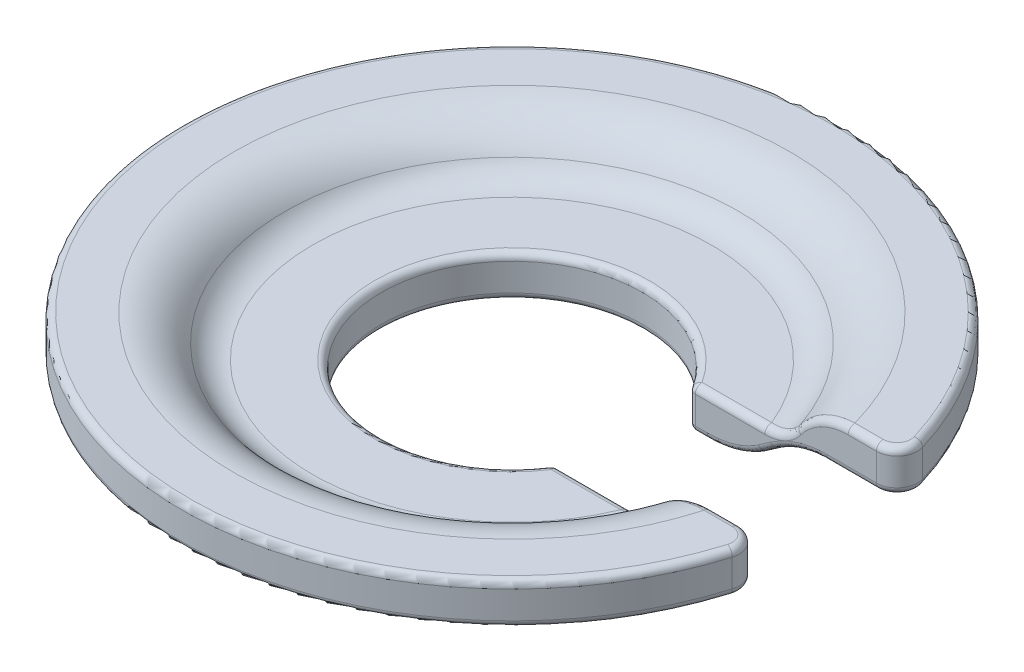
from build123d import *

# Parameters (mm, degrees)
SKETCH2_W          = 25
SKETCH2_H          = 10
CUT_EXTRUDE1_DEPTH = 35.467375879
FILLET1_R          = 1.5
FILLET2_R          = 0.5


with BuildPart() as part:
    # Sketch1 → Revolve1 (revolve)
    with BuildSketch(Plane.XY, mode=Mode.PRIVATE) as revolve1_sk:
        with BuildLine():
            Line((9.5, 0), (10.75, 0))
            ThreePointArc((10.75, 0), (12.653607892, 0.309984447), (14.360519504, 1.207907669))
            ThreePointArc((14.360519504, 1.207907669), (14.760337141, 1.508447301), (15.160821893, 1.808097391))
            ThreePointArc((15.160821893, 1.808097391), (16.859045789, 2.694233238), (18.75, 3))
            Line((18.75, 3), (24, 3))
            Line((24, 3), (24, 6))
            Line((24, 6), (20.244562647, 6))
            ThreePointArc((20.244562647, 6), (18.161467422, 5.488823672), (16.551629517, 4.071428571))
            ThreePointArc((16.551629517, 4.071428571), (15.657275125, 3.283986849), (14.5, 3))
            Line((14.5, 3), (9.5, 3))
            Line((9.5, 3), (9.5, 0))
        make_face()
    revolve(revolve1_sk.sketch.rotate(Axis((0, 0, 0), (0, 1, 0)), 90), axis=Axis((0, 0, 0), (0, 1, 0)))

    # Sketch2 → Cut-Extrude1 (cut, through all)
    with BuildSketch(Plane(origin=(0, 6, 0), x_dir=(1, 0, 0), z_dir=(0, 1, 0))):
        with Locations((12.5, 0)):
            Rectangle(SKETCH2_W, SKETCH2_H)
    extrude(amount=-CUT_EXTRUDE1_DEPTH, mode=Mode.SUBTRACT)

    # Fillet1
    fillet1_edges = [part.edges().sort_by_distance(p)[0] for p in [
        (23.473389189, 4.5, 5),
        (23.473389189, 4.5, -5),
    ]]
    fillet(fillet1_edges, radius=FILLET1_R)

    # Fillet2
    fillet2_edges = [part.edges().sort_by_distance(p)[0] for p in [
        (-9.5, 3, 0),
        (10.8442024, 3, -5),
        (10.8442024, 3, 5),
        (-9.5, 0, 0),
        (20.579028773, 6, 5),
        (13.887204129, 1.508114142, 5),
        (11.583800862, 0.297812756, 5),
        (16.099878641, 2.694023094, 5),
        (8.077747211, 1.5, 5),
        (14.823292304, 3.277026616, 5),
        (22.744818686, 3, 5.605572809),
        (11.583800862, 0.297812756, -5),
        (13.887204129, 1.508114142, -5),
        (16.099878641, 2.694023094, -5),
        (19.805849799, 3, -5),
        (8.077747211, 1.5, -5),
        (22.744818686, 3, -5.605572809),
        (14.823292304, 3.277026616, -5),
        (8.797090183, 0, 5),
        (8.797090183, 0, -5),
        (19.805849799, 3, 5),
        (-24, 3, 0),
        (22.744818686, 3, -5.605572809),
        (22.744818686, 3, 5.605572809),
        (-24, 6, 0),
        (20.579028773, 6, -5),
        (22.744818686, 6, -5.605572809),
        (22.744818686, 6, 5.605572809),
    ]]
    fillet(fillet2_edges, radius=FILLET2_R)


solid = part.part
